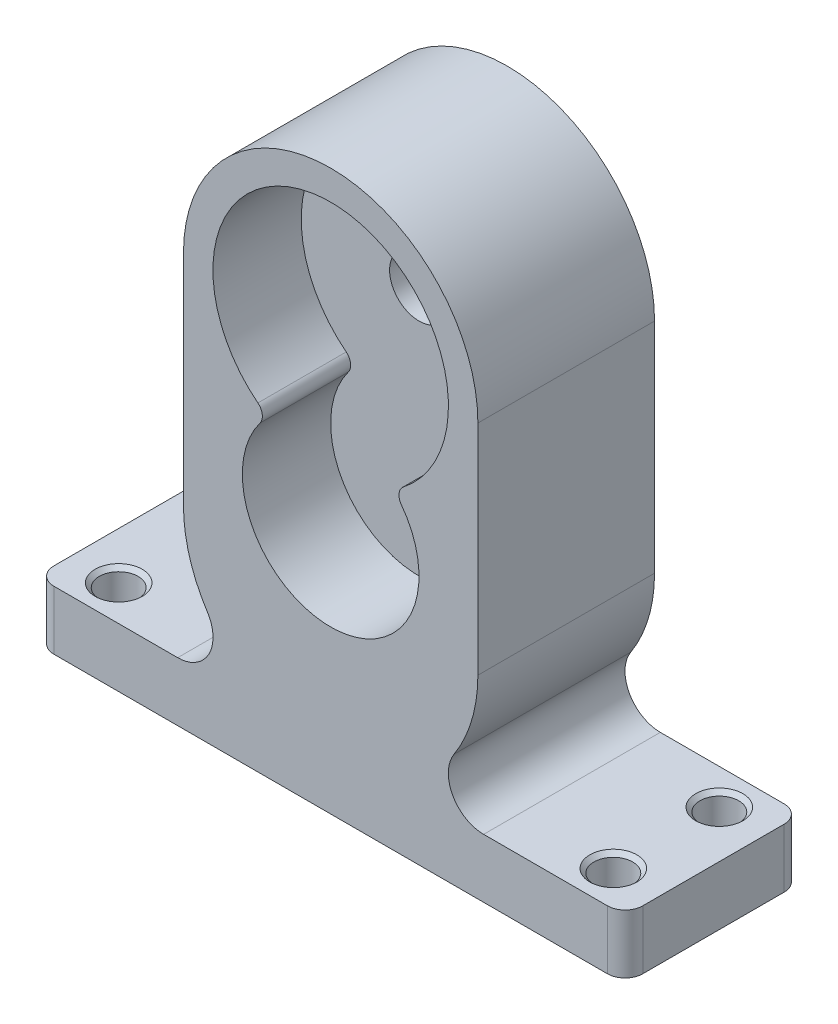
from build123d import *

# Parameters (mm, degrees)
EXTRUDE_1_DEPTH             = 30
SKETCH_2_R                  = 20
CUT_EXTRUDE_1_DEPTH         = 15
SKETCH_3_R                  = 5
CUT_EXTRUDE_2_DEPTH         = 109.397550478
FILLET_5_R                  = 6
SKETCH_4_R                  = 15
CUT_EXTRUDE_3_DEPTH         = 15
FILLET_6_R                  = 2
HOLE_WIZARD_M62_D           = 6.6
HOLE_WIZARD_M62_CSINK_D     = 8
HOLE_WIZARD_M62_CSINK_ANGLE = 90
PATTERN_LINEAR_1_COUNT      = 2
PATTERN_LINEAR_1_PITCH      = 18
PATTERN_LINEAR_1_COUNT_DIR2 = 2
PATTERN_LINEAR_1_PITCH_DIR2 = 84
FILLET_7_R                  = 3


with BuildPart() as part:
    # Эскиз1 → Бобышка-Вытянуть1 (new body)
    with BuildSketch(Plane.XY):
        with BuildLine():
            Line((0, 10), (0, 0))
            Line((0, 0), (50, 0))
            Line((50, 0), (50, 10))
            Line((50, 10), (10, 10))
            ThreePointArc((10, 10), (20.916500663, 19.219814537), (25, 32.912878475))
            Line((25, 32.912878475), (25, 70.000152367))
            ThreePointArc((25, 70.000152367), (17.67766953, 87.677821896), (0, 95.000152367))
            Line((0, 95.000152367), (0, 32.912878475))
            Line((0, 32.912878475), (0, 10))
        make_face()
    extrude_1 = extrude(amount=-EXTRUDE_1_DEPTH)

    # Зеркальное отражение1: Бобышка-Вытянуть1 across plane
    add(extrude_1.mirror(Plane(origin=(0, 95.000152367, -30), x_dir=(0, 0, 1), z_dir=(-1, 0, 0))))

    # Эскиз2 → Вырез-Вытянуть1 (cut)
    with BuildSketch(Plane.XY):
        with Locations((0, 70.000152367)):
            Circle(SKETCH_2_R)
    extrude(amount=-CUT_EXTRUDE_1_DEPTH, mode=Mode.SUBTRACT)

    # Эскиз3 → Вырез-Вытянуть2 (cut, through all)
    with BuildSketch(Plane.XY.offset(-15)):
        with Locations((0, 70.000152367)):
            Circle(SKETCH_3_R)
    extrude(amount=-CUT_EXTRUDE_2_DEPTH, mode=Mode.SUBTRACT)

    # Скругление5
    fillet_5_edges = [part.edges().sort_by_distance(p)[0] for p in [
        (10, 10, -15),
        (-10, 10, -15),
    ]]
    fillet(fillet_5_edges, radius=FILLET_5_R)

    # Эскиз4 → Вырез-Вытянуть3 (cut)
    with BuildSketch(Plane.XY):
        with Locations((0, 42.5)):
            Circle(SKETCH_4_R)
    extrude(amount=-CUT_EXTRUDE_3_DEPTH, mode=Mode.SUBTRACT)

    # Скругление6
    fillet_6_edges = [part.edges().sort_by_distance(p)[0] for p in [
        (10.644789814, 53.068275631, -7.5),
        (-10.644789814, 53.068275631, -7.5),
    ]]
    fillet(fillet_6_edges, radius=FILLET_6_R)

    # Зенковка для винта с полупотайной головкой M62 (through all)
    with Locations(Plane(origin=(42, 10, -24), x_dir=(1, 0, 0), z_dir=(0, 1, 0))):
        with Locations((0, 0)):
            hole_wizard_m62 = CounterSinkHole(HOLE_WIZARD_M62_D / 2, HOLE_WIZARD_M62_CSINK_D / 2, counter_sink_angle=HOLE_WIZARD_M62_CSINK_ANGLE)

    # Линейный массив1: Hole Wizard M62 2 × 2
    with Locations(*[(-j * PATTERN_LINEAR_1_PITCH_DIR2, 0, i * PATTERN_LINEAR_1_PITCH) for i in range(PATTERN_LINEAR_1_COUNT) for j in range(PATTERN_LINEAR_1_COUNT_DIR2) if (i, j) != (0, 0)]):
        add(hole_wizard_m62, mode=Mode.SUBTRACT)

    # Скругление7
    fillet_7_edges = [part.edges().sort_by_distance(p)[0] for p in [
        (50, 5, 0),
        (50, 5, -30),
        (-50, 5, 0),
        (-50, 5, -30),
    ]]
    fillet(fillet_7_edges, radius=FILLET_7_R)


solid = part.part
